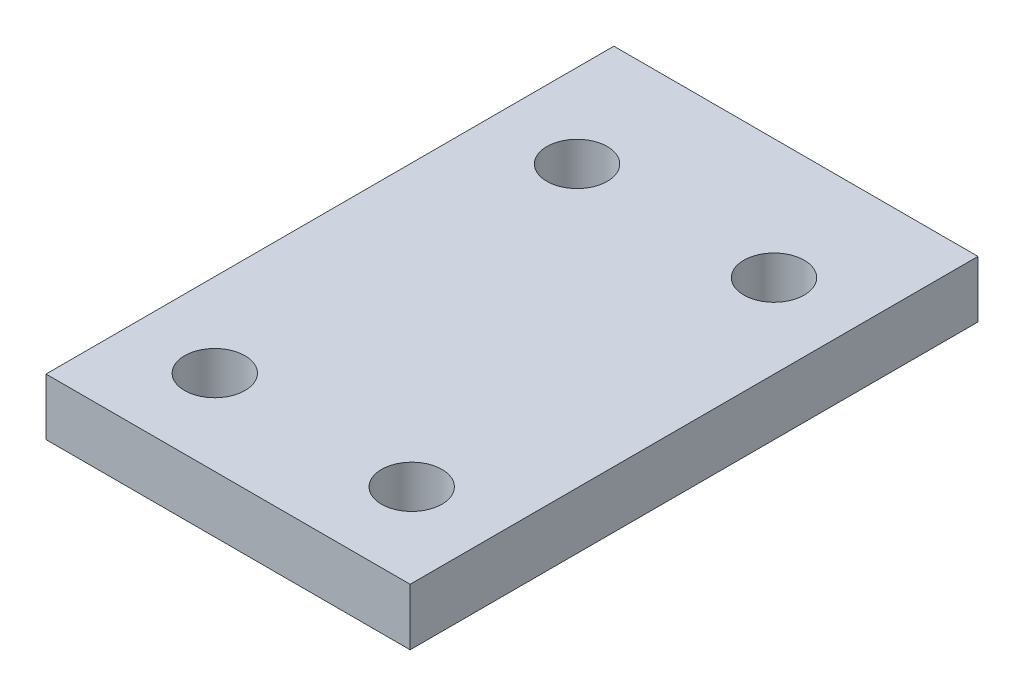
from build123d import *

# Parameters (mm, degrees)
SKETCH1_W           = 40.7162
SKETCH1_H           = 63.5
SKETCH1_R           = 3.3782
BOSS_EXTRUDE1_DEPTH = 6.35


with BuildPart() as part:
    # Sketch1 → Boss-Extrude1 (new body)
    with BuildSketch(Plane(origin=(0, 0, 0), x_dir=(1, 0, 0), z_dir=(0, 1, 0))):
        Rectangle(SKETCH1_W, SKETCH1_H)
        with Locations(Location((11.0109, 18.288, 0), (0, 0, 270))):
            Circle(SKETCH1_R, mode=Mode.SUBTRACT)
        with Locations(Location((11.0109, -22.225, 0), (0, 0, 270))):
            Circle(SKETCH1_R, mode=Mode.SUBTRACT)
        with Locations(Location((-11.0109, -22.225, 0), (0, 0, 90))):
            Circle(SKETCH1_R, mode=Mode.SUBTRACT)
        with Locations(Location((-11.0109, 18.288, 0), (0, 0, 90))):
            Circle(SKETCH1_R, mode=Mode.SUBTRACT)
    extrude(amount=BOSS_EXTRUDE1_DEPTH)


solid = part.part
